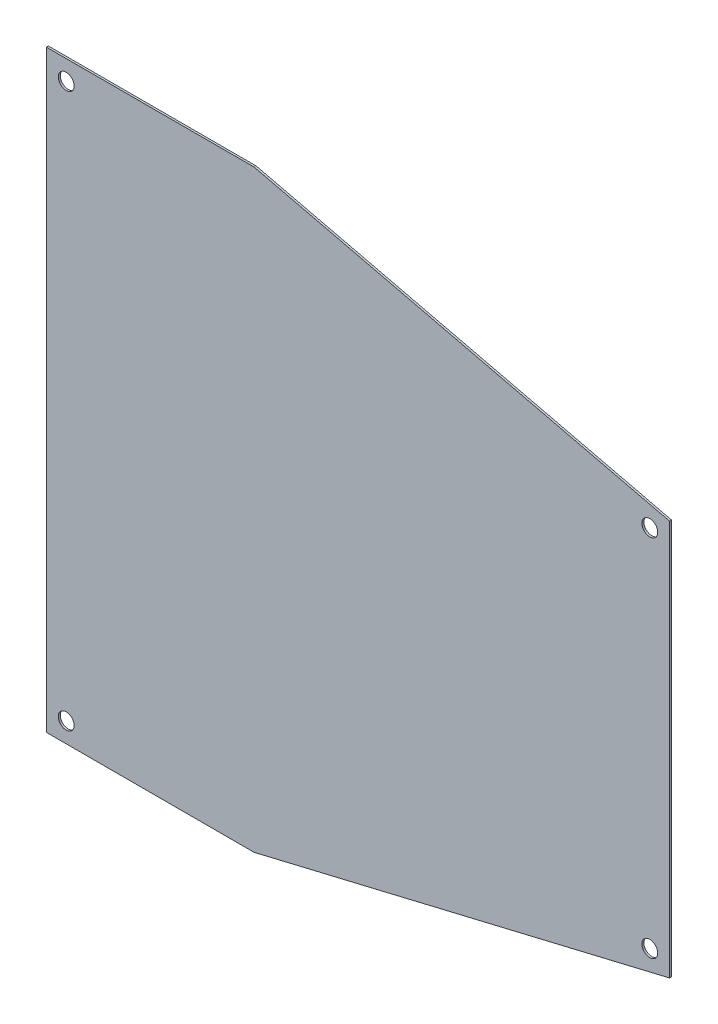
from build123d import *

# Parameters (mm, degrees)
ESBO_O1_R                = 2
RESSALTO_EXTRUS_O1_DEPTH = 0.5


with BuildPart() as part:
    # Esboço1 → Ressalto-extrusão1 (new body)
    # profile 1 of 2: a face of its own
    with BuildSketch(Plane.XY):
        Polygon((210, -50), (210, 0), (52.5, 0), (52.5, -75), (105, -75), align=None)
        with Locations((57.5, -70)):
            Circle(ESBO_O1_R, mode=Mode.SUBTRACT)
        with Locations((205, -46.050706394)):
            Circle(ESBO_O1_R, mode=Mode.SUBTRACT)
    # profile 2 of 2: a face of its own
    with BuildSketch(Plane.XY):
        Polygon((210, 0), (210, 50), (105, 75), (52.5, 75), (52.5, 0), align=None)
        with Locations((57.5, 70)):
            Circle(ESBO_O1_R, mode=Mode.SUBTRACT)
        with Locations((205, 46.050706394)):
            Circle(ESBO_O1_R, mode=Mode.SUBTRACT)
    extrude(amount=RESSALTO_EXTRUS_O1_DEPTH)


solid = part.part
